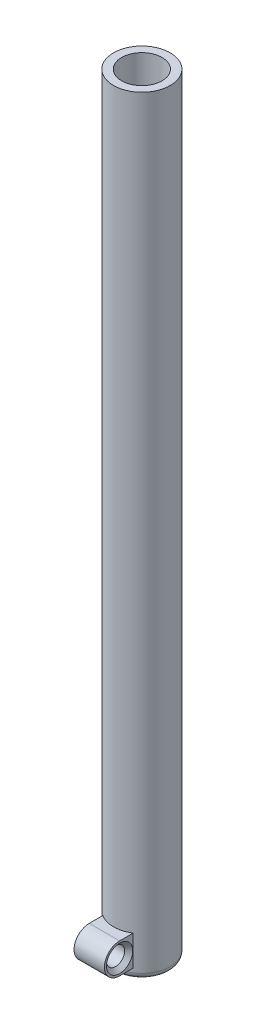
from build123d import *

# Parameters (mm, degrees)
SZKIC1_R                                     = 14
SZKIC1_R_2                                   = 10
DODANIE_WYCI_GNI_CIE1_DEPTH                  = 380
SZKIC2_W                                     = 15
SZKIC2_H                                     = 15
DODANIE_WYCI_GNI_CIE2_DEPTH                  = 12
DODANIE_WYCI_GNI_CIE2_DIRECTION_2_REACH      = 383.287
DODANIE_WYCI_GNI_CIE2_DIRECTION_2_END_RADIUS = 14
ZAOKR_GLENIE1_RADIUS                         = 7.5
ZAOKR_GLENIE1_LENGTH                         = 15
SZKIC3_R                                     = 4.5
WYTNIJ_WYCI_GNI_CIE1_DEPTH                   = 382.4947575
SFAZOWANIE2_SIZE                             = 2
ZAOKR_GLENIE2_R                              = 3


with BuildPart() as part:
    # Szkic1 → Dodanie-wyciągnięcie1 (new body)
    with BuildSketch(Plane(origin=(0, 0, 0), x_dir=(1, 0, 0), z_dir=(0, 1, 0))):
        with Locations(Location((0, 0, 0), (0, 0, 270))):
            Circle(SZKIC1_R)
        with Locations(Location((0, 0, 0), (0, 0, 270))):
            Circle(SZKIC1_R_2, mode=Mode.SUBTRACT)
    extrude(amount=DODANIE_WYCI_GNI_CIE1_DEPTH)

    # Szkic2 → Dodanie-wyciągnięcie2 (add)
    with BuildSketch(Plane.XY.offset(14)):
        with Locations((0, 12.5)):
            Rectangle(SZKIC2_W, SZKIC2_H)
    extrude(amount=DODANIE_WYCI_GNI_CIE2_DEPTH)

    # Dodanie-wyciągnięcie2 direction 2: up to this cylinder (the profile starts outside it)
    dodanie_wyci_gni_cie2_direction_2_end = Plane(origin=(0, 12.5, 0), z_dir=(0, -1, 0)) * Cylinder(DODANIE_WYCI_GNI_CIE2_DIRECTION_2_END_RADIUS, 795.574, mode=Mode.PRIVATE)
    # Szkic2 → Dodanie-wyciągnięcie2 direction 2 (add, up to the surface)
    with BuildSketch(Plane.XY.offset(14), mode=Mode.PRIVATE) as dodanie_wyci_gni_cie2_direction_2_sk1:
        with Locations((0, 12.5)):
            Rectangle(SZKIC2_W, SZKIC2_H)
    dodanie_wyci_gni_cie2_direction_2_tool1 = extrude(dodanie_wyci_gni_cie2_direction_2_sk1.sketch, amount=-DODANIE_WYCI_GNI_CIE2_DIRECTION_2_REACH, mode=Mode.PRIVATE) - dodanie_wyci_gni_cie2_direction_2_end
    add(dodanie_wyci_gni_cie2_direction_2_tool1.solids().sort_by_distance((0, 12.5, 14))[0])
    add(dodanie_wyci_gni_cie2_direction_2_tool1.solids().sort_by_distance((0, 12.5, 14))[1])

    # Zaokrąglenie1: full round fillet: the end face becomes a half cylinder, R = half its width
    zaokr_glenie1_face = Plane((0, 12.5, 26), x_dir=(1, 0, 0), z_dir=(0, 0, 1))  # on the end face: x along it, z out of the body
    zaokr_glenie1_slab = zaokr_glenie1_face.offset(-ZAOKR_GLENIE1_RADIUS / 2) * Box(ZAOKR_GLENIE1_LENGTH, 2 * ZAOKR_GLENIE1_RADIUS, ZAOKR_GLENIE1_RADIUS, mode=Mode.PRIVATE)  # the body's end, R deep
    zaokr_glenie1_round = Plane((0, 12.5, 18.5), x_dir=(0, 0, 1), z_dir=(1, 0, 0)) * Cylinder(ZAOKR_GLENIE1_RADIUS, ZAOKR_GLENIE1_LENGTH, mode=Mode.PRIVATE)  # its axis R under the face
    add(zaokr_glenie1_slab - zaokr_glenie1_round, mode=Mode.SUBTRACT)

    # Szkic3 → Wytnij-wyciągnięcie1 (cut, through all)
    with BuildSketch(Plane(origin=(7.5, 0, 0), x_dir=(0, 0, -1), z_dir=(1, 0, 0))):
        with Locations(Location((-18.5, 12.5, 0), (0, 0, 90))):
            Circle(SZKIC3_R)
    extrude(amount=-WYTNIJ_WYCI_GNI_CIE1_DEPTH, mode=Mode.SUBTRACT)

    # Sfazowanie2
    sfazowanie2_edges = [part.edges().sort_by_distance(p)[0] for p in [
        (-7.5, 8, 18.5),
        (7.5, 8, 18.5),
    ]]
    chamfer(sfazowanie2_edges, length=SFAZOWANIE2_SIZE)

    # Zaokrąglenie2
    zaokr_glenie2_edges = [part.edges().sort_by_distance(p)[0] for p in [
        (0, 0, -14),
    ]]
    fillet(zaokr_glenie2_edges, radius=ZAOKR_GLENIE2_R)


solid = part.part
